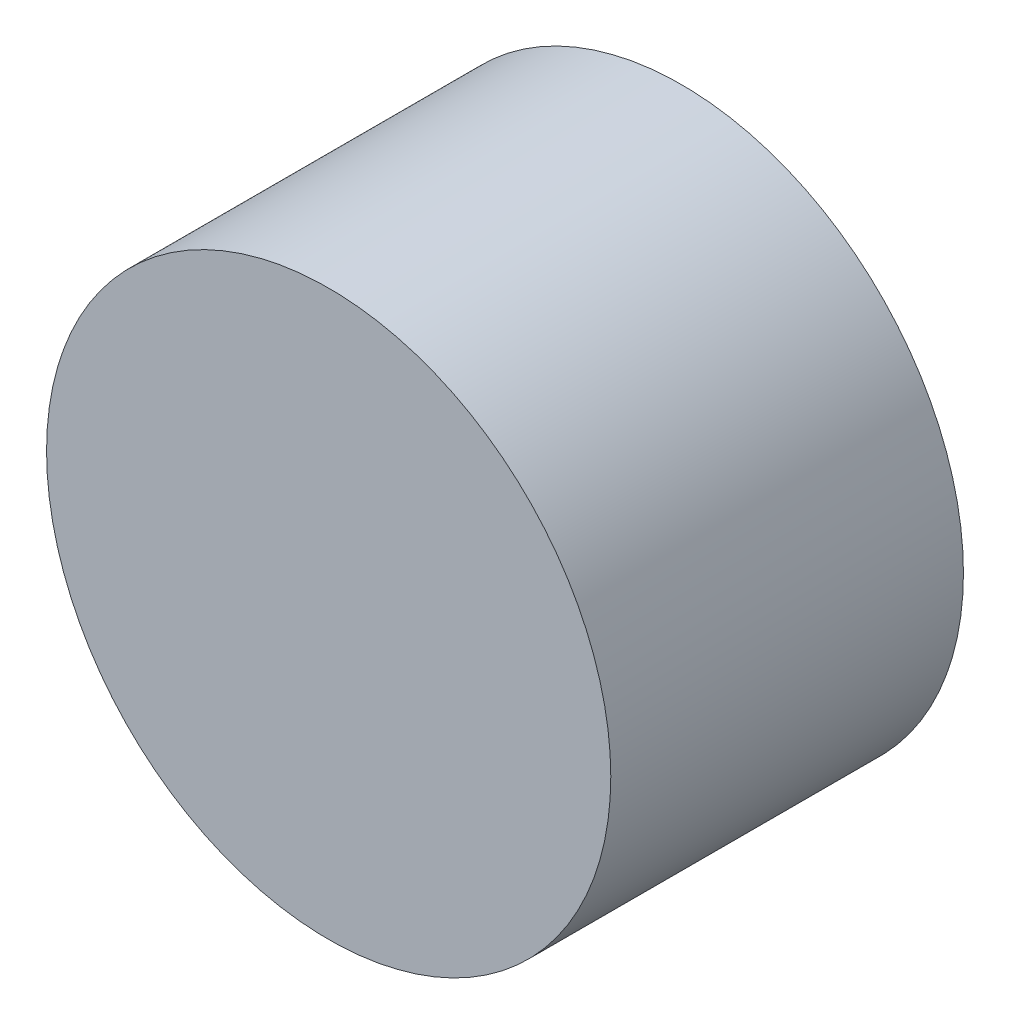
from build123d import *

# Parameters (mm, degrees)
SKETCH1_R           = 10
BOSS_EXTRUDE1_DEPTH = 12.5


with BuildPart() as part:
    # Sketch1 → Boss-Extrude1 (new body)
    with BuildSketch(Plane.XY):
        Circle(SKETCH1_R)
    extrude(amount=BOSS_EXTRUDE1_DEPTH)


solid = part.part
